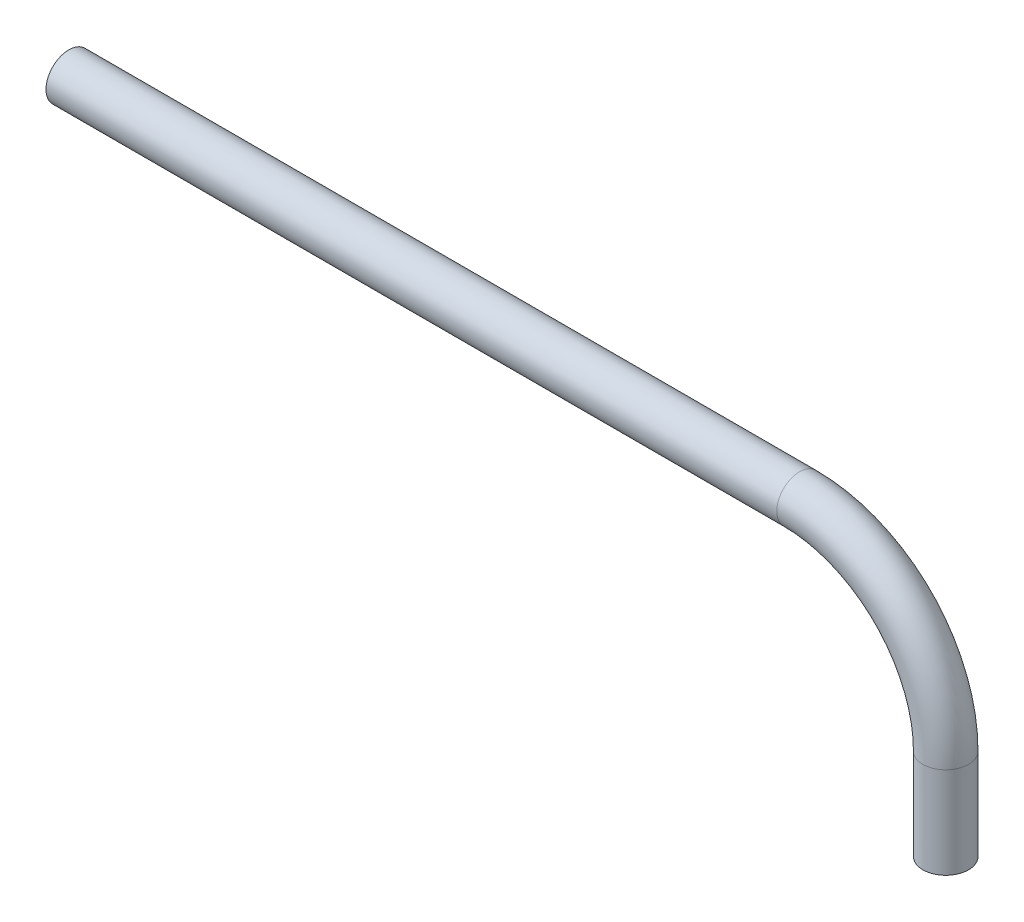
from build123d import *

# Parameters (mm, degrees)
SWEEP1_PROFILE_R = 2.5


with BuildPart() as part:
    # Sweep1: sweep along a path in Sketch1
    with BuildLine(Plane.XY) as sweep1_path:
        Line((0, 0), (80, 0))
        ThreePointArc((80, 0), (91.313708499, -4.686291501), (96, -16))
        Line((96, -16), (96, -26))
    # Sweep1 profile (on start of the path) → Sweep1 (sweep)
    with BuildSketch(Plane(origin=(0, 0, 0), x_dir=(0, 0, 1), z_dir=(1, 0, 0))):
        Circle(SWEEP1_PROFILE_R)
    sweep(path=sweep1_path.line)


solid = part.part
